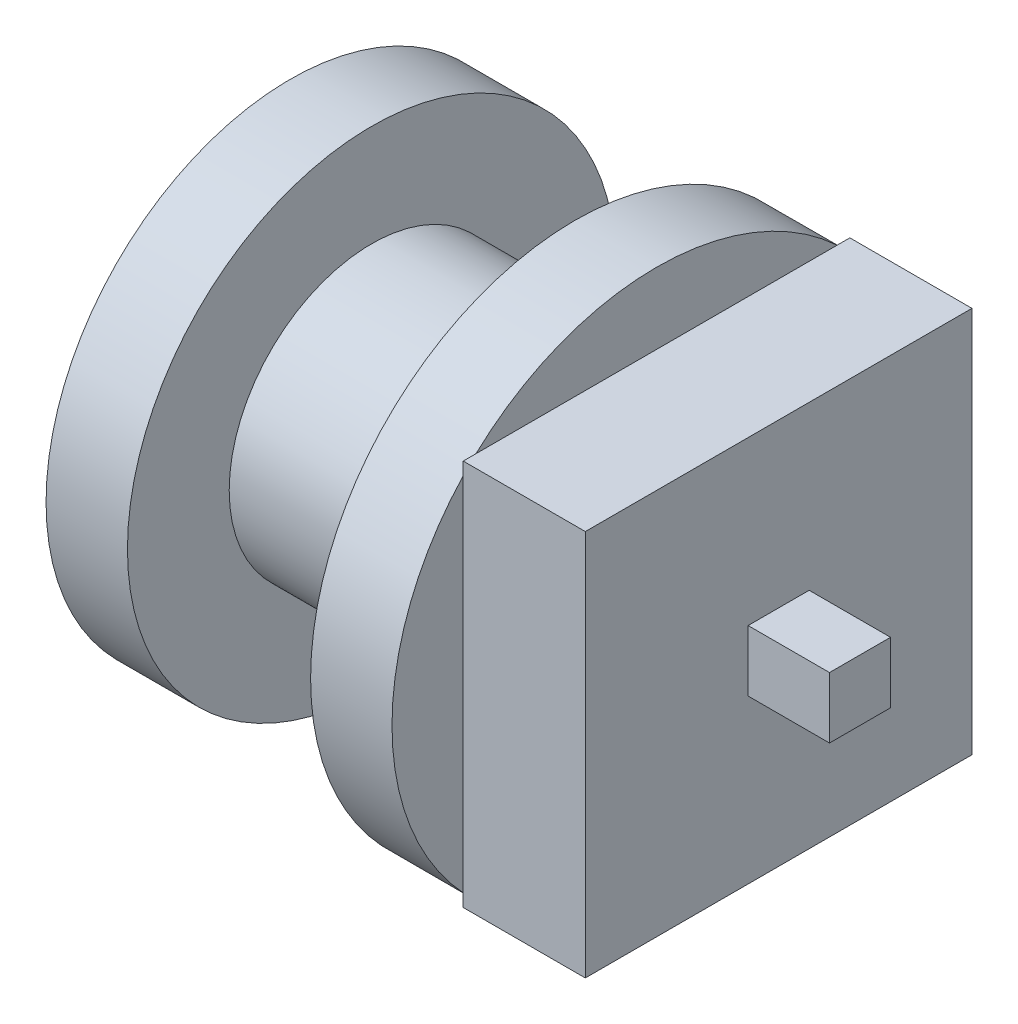
from build123d import *

# Parameters (mm, degrees)
SKETCH1_W           = 3
SKETCH1_H           = 3
BOSS_EXTRUDE1_DEPTH = 4
SKETCH2_W           = 19
SKETCH2_H           = 19
BOSS_EXTRUDE2_DEPTH = 6
SKETCH3_R           = 13
BOSS_EXTRUDE3_DEPTH = 4
SKETCH4_R           = 7
BOSS_EXTRUDE4_DEPTH = 10
SKETCH5_R           = 12
BOSS_EXTRUDE5_DEPTH = 4
SKETCH6_R           = 5
CUT_EXTRUDE1_DEPTH  = 6


with BuildPart() as part:
    # Sketch1 → Boss-Extrude1 (new body)
    with BuildSketch(Plane(origin=(0, 0, 0), x_dir=(0, 0, -1), z_dir=(1, 0, 0))):
        Rectangle(SKETCH1_W, SKETCH1_H)
    extrude(amount=BOSS_EXTRUDE1_DEPTH)

    # Sketch2 → Boss-Extrude2 (add)
    with BuildSketch(Plane.ZY):
        Rectangle(SKETCH2_W, SKETCH2_H)
    extrude(amount=BOSS_EXTRUDE2_DEPTH)

    # Sketch3 → Boss-Extrude3 (add)
    with BuildSketch(Plane.ZY.offset(6)):
        with Locations(Location((0, 0, 0), (0, 0, 136.9509202))):
            Circle(SKETCH3_R)
    extrude(amount=BOSS_EXTRUDE3_DEPTH)

    # Sketch4 → Boss-Extrude4 (add)
    with BuildSketch(Plane.ZY.offset(10)):
        Circle(SKETCH4_R)
    extrude(amount=BOSS_EXTRUDE4_DEPTH)

    # Sketch5 → Boss-Extrude5 (add)
    with BuildSketch(Plane.ZY.offset(20)):
        Circle(SKETCH5_R)
    extrude(amount=BOSS_EXTRUDE5_DEPTH)

    # Sketch6 → Cut-Extrude1 (cut)
    with BuildSketch(Plane.ZY.offset(24)):
        Circle(SKETCH6_R)
    extrude(amount=-CUT_EXTRUDE1_DEPTH, mode=Mode.SUBTRACT)


solid = part.part
